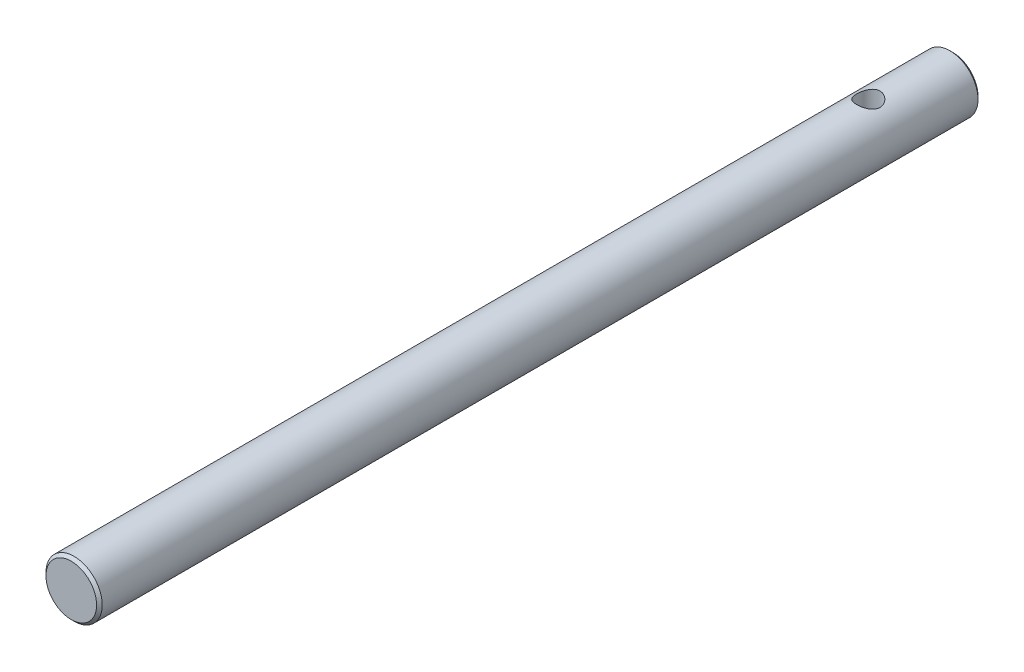
from build123d import *

# Parameters (mm, degrees)
ESQUISSE1_R                  = 3
BOSS_EXTRU_1_DEPTH           = 94
ENL_V_MAT_EXTRU_1_DEPTH      = 95.09569597
ENL_V_MAT_EXTRU_1_DEPTH_BACK = 95.09569597
ESQUISSE2_R                  = 1.25
CHANFREIN1_SIZE              = 0.3


with BuildPart() as part:
    # Esquisse1 → Boss.-Extru.1 (new body)
    with BuildSketch(Plane.XY):
        Circle(ESQUISSE1_R)
    extrude(amount=BOSS_EXTRU_1_DEPTH)

    # Esquisse2 → Enlèv. mat.-Extru.1 (cut, two sides: drawn at the far end of the back side and taken through both)
    with BuildSketch(Plane(origin=(0, 0, 0), x_dir=(1, 0, 0), z_dir=(0, 1, 0)).offset(-ENL_V_MAT_EXTRU_1_DEPTH_BACK)):
        with Locations(Location((0, -9, 0), (0, 0, 270))):
            Circle(ESQUISSE2_R)
    extrude(amount=ENL_V_MAT_EXTRU_1_DEPTH + ENL_V_MAT_EXTRU_1_DEPTH_BACK, mode=Mode.SUBTRACT)

    # Chanfrein1
    chanfrein1_edges = [part.edges().sort_by_distance(p)[0] for p in [
        (-3, 0, 0),
        (-3, 0, 94),
    ]]
    chamfer(chanfrein1_edges, length=CHANFREIN1_SIZE)


solid = part.part
